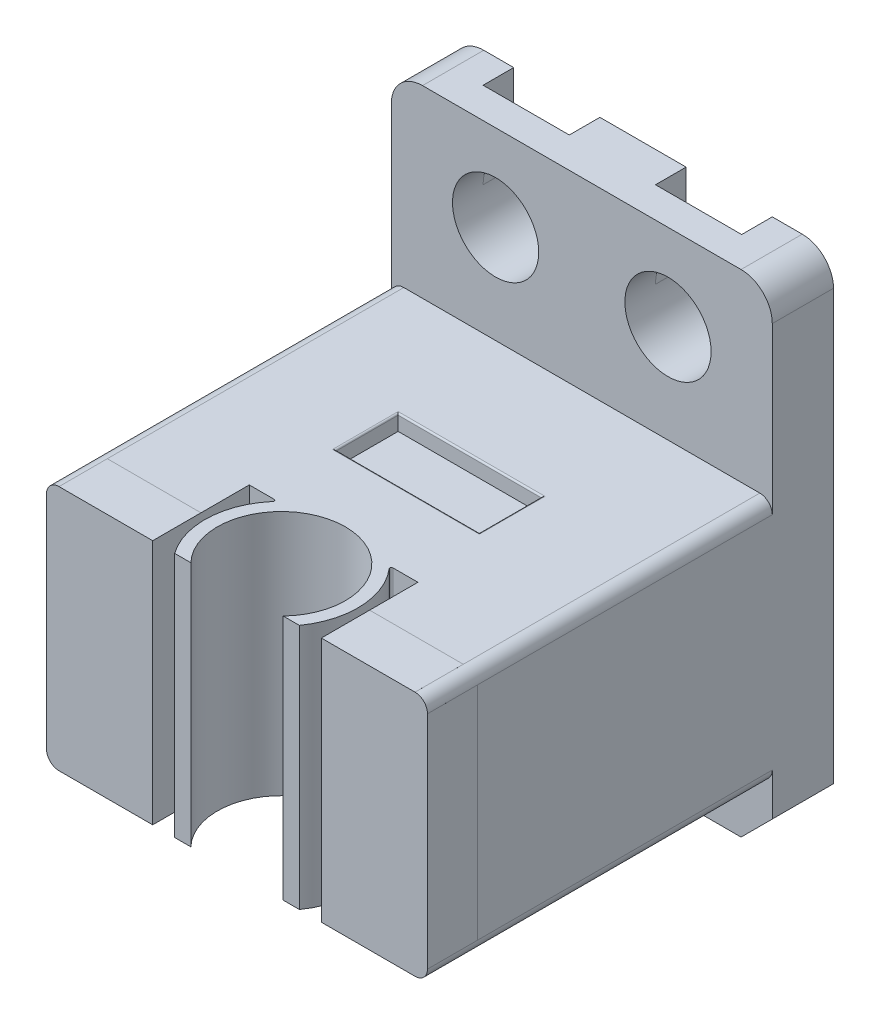
from build123d import *
from build123d.topology import SkipClean

# Parameters (mm, degrees)
SKETCH2_R                       = 1.7526
BOSS_EXTRUDE1_DEPTH             = 2.4892
BOSS_EXTRUDE2_DEPTH             = 14.0208
SKETCH4_R                       = 2.6035
CUT_EXTRUDE3_DEPTH              = 26.275820647
SKETCH5_W                       = 5.842
SKETCH5_H                       = 2.54
CUT_EXTRUDE4_DEPTH              = 0.635
FILLET1_R                       = 0.06477
BOSS_EXTRUDE3_REACH             = 29.059
SKETCH6_R                       = 2.6035
BOSS_EXTRUDE3_DIRECTION_2_DEPTH = 1.27
SKETCH7_R                       = 2.3495
BOSS_EXTRUDE4_DEPTH             = 0.7366
FILLET2_R                       = 0.127
SKETCH8_W                       = 3.5052
SKETCH8_H                       = 1.2446
CUT_EXTRUDE5_DEPTH              = 3.5052
CHAMFER1_SIZE                   = 1.27
SKETCH11_W                      = 3.81
SKETCH11_H                      = 1.963784076
BOSS_EXTRUDE5_DEPTH             = 0.000254
SKETCH12_W                      = 2.032
SKETCH12_H                      = 8.9916
BOSS_EXTRUDE6_DEPTH             = 0.000254
SKETCH14_W                      = 3.81
SKETCH14_H                      = 1.963784076
SKETCH14_H_2                    = 2.032
BOSS_EXTRUDE7_DEPTH             = 0.000254
SKETCH15_W                      = 2.032
SKETCH15_H                      = 8.9916
BOSS_EXTRUDE8_DEPTH             = 0.000254
SKETCH19_W                      = 0.142467949
SKETCH19_H                      = 1.160096154
BOSS_EXTRUDE9_DEPTH             = 0.000254


with BuildPart() as part:
    # Sketch2 → Boss-Extrude1 (new body)
    with BuildSketch(Plane.XY):
        with BuildLine():
            Line((-6.477, 9.9949), (6.477, 9.9949))
            ThreePointArc((6.477, 9.9949), (7.375025612, 9.622925612), (7.747, 8.7249))
            Line((7.747, 8.7249), (7.747, -9.9949))
            Line((7.747, -9.9949), (-7.747, -9.9949))
            Line((-7.747, -9.9949), (-7.747, 8.7249))
            ThreePointArc((-7.747, 8.7249), (-7.375025612, 9.622925612), (-6.477, 9.9949))
        make_face()
        with Locations((-3.5052, 6.4897)):
            Circle(SKETCH2_R, mode=Mode.SUBTRACT)
        with Locations((3.5052, 6.4897)):
            Circle(SKETCH2_R, mode=Mode.SUBTRACT)
    extrude(amount=BOSS_EXTRUDE1_DEPTH)

    # Sketch3 → Boss-Extrude2 (add)
    with BuildSketch(Plane.XY.offset(2.4892)):
        with BuildLine():
            Line((-7.239, 2.5019), (7.239, 2.5019))
            ThreePointArc((7.239, 2.5019), (7.598210245, 2.353110245), (7.747, 1.9939))
            Line((7.747, 1.9939), (7.747, -6.9977))
            ThreePointArc((7.747, -6.9977), (7.598210245, -7.356910245), (7.239, -7.5057))
            Line((7.239, -7.5057), (-7.239, -7.5057))
            ThreePointArc((-7.239, -7.5057), (-7.598210245, -7.356910245), (-7.747, -6.9977))
            Line((-7.747, -6.9977), (-7.747, 1.9939))
            ThreePointArc((-7.747, 1.9939), (-7.598210245, 2.353110245), (-7.239, 2.5019))
        make_face()
    extrude(amount=BOSS_EXTRUDE2_DEPTH)

    # Sketch4 → Cut-Extrude3 (cut, through all)
    with BuildSketch(Plane.XZ.offset(7.5057)):
        with Locations((0, 14.7066)):
            Circle(SKETCH4_R)
        with BuildLine():
            Line((-3.429, 12.582431848), (-2.413, 12.582431848))
            ThreePointArc((-2.413, 12.582431848), (-2.356345068, 12.618703282), (-2.365572682, 12.685338479))
            ThreePointArc((-2.365572682, 12.685338479), (-3.108430548, 14.568426992), (-2.535582909, 16.51))
            Line((-2.535582909, 16.51), (-3.429, 16.51))
            Line((-3.429, 16.51), (-3.429, 12.582431848))
        make_face()
        with BuildLine():
            Line((3.429, 16.51), (3.429, 12.582431848))
            Line((3.429, 12.582431848), (2.413, 12.582431848))
            ThreePointArc((2.413, 12.582431848), (2.356345068, 12.618703282), (2.365572682, 12.685338479))
            ThreePointArc((2.365572682, 12.685338479), (3.108430548, 14.568426992), (2.535582909, 16.51))
            Line((2.535582909, 16.51), (3.429, 16.51))
        make_face()
    extrude(amount=-CUT_EXTRUDE3_DEPTH, mode=Mode.SUBTRACT)

    # Sketch5 → Cut-Extrude4 (cut)
    with BuildSketch(Plane(origin=(0, 2.5019, 0), x_dir=(1, 0, 0), z_dir=(0, 1, 0))):
        with Locations((0, -8.3058)):
            Rectangle(SKETCH5_W, SKETCH5_H)
    extrude(amount=-CUT_EXTRUDE4_DEPTH, mode=Mode.SUBTRACT)

    # Fillet1
    fillet1_edges = [part.edges().sort_by_distance(p)[0] for p in [
        (-2.921, 2.5019, 8.3058),
        (0, 2.5019, 7.0358),
        (2.921, 2.5019, 8.3058),
        (0, 2.5019, 9.5758),
    ]]
    fillet(fillet1_edges, radius=FILLET1_R)

    # Sketch6 → Boss-Extrude3 (add, up to next)
    with BuildSketch(Plane.XZ.offset(9.9949), mode=Mode.PRIVATE) as boss_extrude3_sk1:
        with Locations((0, 2.9972)):
            Circle(SKETCH6_R)
    boss_extrude3_tool1 = extrude(boss_extrude3_sk1.sketch, amount=-BOSS_EXTRUDE3_REACH, mode=Mode.PRIVATE) - part.part
    add(boss_extrude3_tool1.solids().sort_by_distance((0, -9.9949, 2.9972))[0])

    # Sketch6 → Boss-Extrude3 direction 2 (add)
    with SkipClean():  # the faces are left unmerged after this step: merging them gives an invalid solid
        with BuildSketch(Plane.XZ.offset(9.9949)):
            with Locations((0, 2.9972)):
                Circle(SKETCH6_R)
        extrude(amount=BOSS_EXTRUDE3_DIRECTION_2_DEPTH)
    add(part.part.scale(1), mode=Mode.REPLACE)  # the faces are merged on a copy

    # Sketch7 → Boss-Extrude4 (add)
    with BuildSketch(Plane.XZ.offset(11.2649)):
        with Locations((0, 2.9972)):
            Circle(SKETCH7_R)
    extrude(amount=BOSS_EXTRUDE4_DEPTH)

    # Fillet2
    fillet2_edges = [part.edges().sort_by_distance(p)[0] for p in [
        (-2.3495, -11.2649, 2.9972),
    ]]
    fillet(fillet2_edges, radius=FILLET2_R)

    # Sketch8 → Cut-Extrude5 (cut)
    with SkipClean():  # the faces are left unmerged after this step: merging them gives an invalid solid
        with BuildSketch(Plane(origin=(0, 9.9949, 0), x_dir=(1, 0, 0), z_dir=(0, 1, 0))):
            with Locations((3.5052, -0.6223)):
                Rectangle(SKETCH8_W, SKETCH8_H)
            with Locations((-3.5052, -0.6223)):
                Rectangle(SKETCH8_W, SKETCH8_H)
        extrude(amount=-CUT_EXTRUDE5_DEPTH, mode=Mode.SUBTRACT)

    # Chamfer1
    chamfer1_edges = [part.edges().sort_by_distance(p)[0] for p in [
        (-7.747, -9.9949, 1.2446),
        (7.747, -9.9949, 1.2446),
    ]]
    chamfer(chamfer1_edges, length=CHAMFER1_SIZE)

    # Sketch11 → Boss-Extrude5 (add)
    with SkipClean():  # the faces are left unmerged after this step: merging them gives an invalid solid
        with BuildSketch(Plane(origin=(0, 2.5019, 0), x_dir=(1, 0, 0), z_dir=(0, 1, 0))):
            with Locations((5.334, -15.528107962)):
                Rectangle(SKETCH11_W, SKETCH11_H)
            with Locations((-5.334, -15.528107962)):
                Rectangle(SKETCH11_W, SKETCH11_H)
        extrude(amount=BOSS_EXTRUDE5_DEPTH)

    # Sketch12 → Boss-Extrude6 (add)
    with SkipClean():  # the faces are left unmerged after this step: merging them gives an invalid solid
        with BuildSketch(Plane(origin=(7.747, 0, 0), x_dir=(0, 0, -1), z_dir=(1, 0, 0))):
            with Locations((-15.494, -2.5019)):
                Rectangle(SKETCH12_W, SKETCH12_H)
        extrude(amount=BOSS_EXTRUDE6_DEPTH)

    # Sketch14 → Boss-Extrude7 (add)
    with SkipClean():  # the faces are left unmerged after this step: merging them gives an invalid solid
        with BuildSketch(Plane.XZ.offset(7.5057)):
            with Locations((-5.334, 15.528107962)):
                Rectangle(SKETCH14_W, SKETCH14_H)
            with Locations((5.334, 15.494)):
                Rectangle(SKETCH14_W, SKETCH14_H_2)
        extrude(amount=BOSS_EXTRUDE7_DEPTH)

    # Sketch15 → Boss-Extrude8 (add)
    with SkipClean():  # the faces are left unmerged after this step: merging them gives an invalid solid
        with BuildSketch(Plane.ZY.offset(7.747)):
            with Locations((15.494, -2.5019)):
                Rectangle(SKETCH15_W, SKETCH15_H)
        extrude(amount=BOSS_EXTRUDE8_DEPTH)

    # Sketch19 → Boss-Extrude9 (add)
    # profile 1 of 10: a face of its own
    with SkipClean():  # the faces are left unmerged after this step: merging them gives an invalid solid
        with BuildSketch(Plane.ZY.offset(7.747)):
            with BuildLine():
                Line((2.754533945, -1.406853602), (3.065864574, -1.406853602))
                add(Edge.make_bspline(
                    [(3.065864574, -1.406853602), (3.087278092, -1.40687714), (3.128307344, -1.406922241), (3.187142387, -1.408289644), (3.240577515, -1.410116037), (3.288497509, -1.412647824), (3.331049811, -1.415639849), (3.368041872, -1.419836309), (3.399764456, -1.424217943), (3.418772024, -1.428672653), (3.427440595, -1.430704263)],
                    knots=[0, 0, 0, 0, 1.415646017, 2.712440637, 3.8905458, 4.950247383, 5.884950622, 6.709939814, 7.411656543, 8, 8, 8, 8], degree=3))
                add(Edge.make_bspline(
                    [(3.427440595, -1.430704263), (3.438414091, -1.43370779), (3.460102506, -1.43964407), (3.49135405, -1.451533866), (3.521087402, -1.465631848), (3.549404573, -1.481699135), (3.575957589, -1.500425088), (3.601142615, -1.521050621), (3.624737392, -1.54405194), (3.646609237, -1.569171061), (3.666695556, -1.595986299), (3.683990091, -1.624897954), (3.698471369, -1.655419366), (3.710891638, -1.687529307), (3.71983083, -1.721497418), (3.72656496, -1.757087677), (3.730839248, -1.794296269), (3.731248624, -1.819723423), (3.731457022, -1.832667404)],
                    knots=[0, 0, 0, 0, 0.999701418, 1.975846123, 2.934577507, 3.890451536, 4.834027766, 5.787354733, 6.749476667, 7.726910423, 8.712836071, 9.690891519, 10.682875813, 11.679750201, 12.712814741, 13.765529915, 14.8625177, 16, 16, 16, 16], degree=3))
                add(Edge.make_bspline(
                    [(3.731457022, -1.832667404), (3.731265876, -1.845720181), (3.730891885, -1.871258822), (3.726403213, -1.908620765), (3.720357019, -1.944325177), (3.711060141, -1.978292892), (3.698883711, -2.010322188), (3.684599816, -2.040902533), (3.667371572, -2.06951367), (3.647575524, -2.09625947), (3.625553908, -2.121165037), (3.601399897, -2.14404989), (3.575211003, -2.164780072), (3.547070457, -2.183402057), (3.516703919, -2.199484012), (3.484571942, -2.213888218), (3.450395237, -2.225985449), (3.426744882, -2.232349084), (3.414720243, -2.235584571)],
                    knots=[0, 0, 0, 0, 1.121902311, 2.195077645, 3.232258892, 4.234102512, 5.217864754, 6.176164875, 7.132989551, 8.084763148, 9.034132444, 9.988522005, 10.94243251, 11.903244335, 12.886203696, 13.894208494, 14.929344452, 16, 16, 16, 16], degree=3))
                add(Edge.make_bspline(
                    [(3.414720243, -2.235584571), (3.404774631, -2.237699566), (3.382978243, -2.242334701), (3.347081366, -2.247509251), (3.305286851, -2.251925948), (3.257651746, -2.255237536), (3.204218807, -2.258072524), (3.144959129, -2.26032591), (3.079756387, -2.261564093), (3.034276216, -2.261627953), (3.01053104, -2.261661294)],
                    knots=[0, 0, 0, 0, 0.601384939, 1.31797006, 2.144135048, 3.087295005, 4.142315834, 5.309527816, 6.595305764, 8, 8, 8, 8], degree=3))
                Line((3.01053104, -2.261661294), (2.897001894, -2.261661294))
                Line((2.897001894, -2.261661294), (2.897001894, -2.994353602))
                Line((2.897001894, -2.994353602), (2.754533945, -2.994353602))
                Line((2.754533945, -2.994353602), (2.754533945, -1.406853602))
            make_face()
            with BuildLine():
                Line((2.897001894, -1.569674115), (2.897001894, -2.098840781))
                Line((2.897001894, -2.098840781), (3.174941597, -2.102338878))
                add(Edge.make_bspline(
                    [(3.174941597, -2.102338878), (3.188512421, -2.102345892), (3.214710616, -2.102359432), (3.252554903, -2.100551849), (3.287665544, -2.098465178), (3.31993469, -2.095409956), (3.349376889, -2.091091386), (3.376041233, -2.086731776), (3.399720964, -2.080424701), (3.427433817, -2.071932452), (3.458314478, -2.057448729), (3.491909402, -2.036425744), (3.520380346, -2.009628422), (3.545017574, -1.979498656), (3.564569168, -1.945980122), (3.578882065, -1.910116712), (3.587291804, -1.872276223), (3.58841947, -1.846382674), (3.588989073, -1.833303421)],
                    knots=[0, 0, 0, 0, 1.160613943, 2.240541288, 3.23993089, 4.169200891, 5.011653406, 5.7853311, 6.478053781, 7.106038997, 8.262395093, 9.384106736, 10.481365981, 11.59014053, 12.70357646, 13.786202915, 14.881775077, 16, 16, 16, 16], degree=3))
                add(Edge.make_bspline(
                    [(3.588989073, -1.833303421), (3.588416373, -1.820540596), (3.587277915, -1.795169678), (3.578816149, -1.757986454), (3.564596996, -1.722500974), (3.544886326, -1.689402467), (3.520964456, -1.659381117), (3.493160826, -1.633302063), (3.461540882, -1.612337219), (3.432127577, -1.598805695), (3.406001325, -1.590543767), (3.383308258, -1.584763071), (3.357685702, -1.580147707), (3.329125316, -1.576410504), (3.297848466, -1.573211255), (3.263586445, -1.571040473), (3.226469042, -1.569769812), (3.200701391, -1.569706786), (3.187343941, -1.569674115)],
                    knots=[0, 0, 0, 0, 1.120700087, 2.227813068, 3.331159281, 4.466773991, 5.599788987, 6.693661531, 7.80175334, 8.91857717, 9.525282508, 10.207424825, 10.974604443, 11.810962634, 12.737642355, 13.736264703, 14.826523623, 16, 16, 16, 16], degree=3))
                Line((3.187343941, -1.569674115), (2.897001894, -1.569674115))
            make_face(mode=Mode.SUBTRACT)
        # profile 2 of 10: a face of its own
        with BuildSketch(Plane.ZY.offset(7.747)):
            with BuildLine():
                Line((5.196841637, -1.834257448), (5.196841637, -2.994353602))
                Line((5.196841637, -2.994353602), (5.054373688, -2.994353602))
                Line((5.054373688, -2.994353602), (5.054373688, -2.79369004))
                add(Edge.make_bspline(
                    [(5.054373688, -2.79369004), (5.038308737, -2.811850856), (5.006957782, -2.847291916), (4.954596989, -2.893593473), (4.89909428, -2.931865069), (4.840719038, -2.962775924), (4.779523978, -2.985995178), (4.715644752, -3.0024989), (4.649055305, -3.013109675), (4.603583701, -3.014169228), (4.580540555, -3.014706166)],
                    knots=[0, 0, 0, 0, 1.074387032, 2.096679803, 3.090159297, 4.057316773, 5.018401886, 5.985159533, 6.978961417, 8, 8, 8, 8], degree=3))
                add(Edge.make_bspline(
                    [(4.580540555, -3.014706166), (4.560053662, -3.014149918), (4.519652601, -3.013052974), (4.460221556, -3.004542929), (4.403029714, -2.99087654), (4.348023033, -2.971871494), (4.295557452, -2.946661621), (4.245183766, -2.916480412), (4.197162938, -2.880539035), (4.152226918, -2.839450894), (4.110846689, -2.794821739), (4.074533184, -2.747221438), (4.044255894, -2.696855821), (4.0189375, -2.644362569), (3.999435587, -2.589337588), (3.985840403, -2.531971158), (3.977340271, -2.472331108), (3.97624378, -2.431718539), (3.975687791, -2.411125437)],
                    knots=[0, 0, 0, 0, 1.033919861, 2.038935746, 3.024066025, 3.998881131, 4.97069526, 5.957263378, 6.95902576, 7.993208707, 9.027059324, 10.027763471, 11.009749337, 11.988697705, 12.965288445, 13.950418724, 14.960734635, 16, 16, 16, 16], degree=3))
                add(Edge.make_bspline(
                    [(3.975687791, -2.411125437), (3.976256103, -2.390957971), (3.977379625, -2.35108798), (3.985749478, -2.292450856), (3.999824257, -2.235972931), (4.019576317, -2.181836031), (4.044904632, -2.129974651), (4.075714872, -2.080352111), (4.11200926, -2.032831706), (4.153852316, -1.988530828), (4.199179873, -1.947609335), (4.247670619, -1.912045233), (4.298118321, -1.881330805), (4.351305472, -1.856995121), (4.406444838, -1.837305991), (4.464027294, -1.823683895), (4.52381326, -1.815656896), (4.56440359, -1.814494499), (4.584992679, -1.813904884)],
                    knots=[0, 0, 0, 0, 1.020392517, 2.01726096, 2.990465484, 3.961182959, 4.928053699, 5.906110375, 6.912531644, 7.948652711, 8.985773172, 9.998621852, 10.987621588, 11.969261332, 12.953316658, 13.946091881, 14.958173133, 16, 16, 16, 16], degree=3))
                add(Edge.make_bspline(
                    [(4.584992679, -1.813904884), (4.608669043, -1.814557007), (4.655097277, -1.815835789), (4.723009624, -1.826477812), (4.787255512, -1.844456688), (4.848330879, -1.868912125), (4.906016405, -1.901409941), (4.959765973, -1.942403709), (5.010142102, -1.99163489), (5.039343163, -2.029449342), (5.054373688, -2.048913397)],
                    knots=[0, 0, 0, 0, 1.038897134, 2.037228247, 3.008116434, 3.962042015, 4.918381754, 5.904844433, 6.921570401, 8, 8, 8, 8], degree=3))
                Line((5.054373688, -2.048913397), (5.054373688, -1.834257448))
                Line((5.054373688, -1.834257448), (5.196841637, -1.834257448))
            make_face()
            with BuildLine():
                add(Edge.make_bspline(
                    [(4.586900732, -1.956372832), (4.5660753, -1.957113804), (4.52496921, -1.958576364), (4.464624252, -1.969994342), (4.406878525, -1.988991997), (4.352020841, -2.014973431), (4.300917757, -2.047643608), (4.255245985, -2.087159378), (4.214631974, -2.132442595), (4.180474297, -2.18328891), (4.152629322, -2.237798258), (4.133049989, -2.294777914), (4.120137152, -2.353200171), (4.11881793, -2.39282539), (4.11815574, -2.412715481)],
                    knots=[0, 0, 0, 0, 1.031046209, 2.035121221, 3.029706178, 4.034933723, 5.034054252, 6.02443088, 7.017295772, 8.038157696, 9.050218397, 10.03989886, 11.016116709, 12, 12, 12, 12], degree=3))
                add(Edge.make_bspline(
                    [(4.11815574, -2.412715481), (4.119001602, -2.432486708), (4.120690011, -2.471951666), (4.132823362, -2.53045357), (4.15317959, -2.587446654), (4.18095724, -2.642447176), (4.215740102, -2.693512107), (4.256057455, -2.73965852), (4.30229919, -2.779341297), (4.353519881, -2.812559768), (4.40822421, -2.839394197), (4.465752457, -2.858065755), (4.525023193, -2.870120677), (4.565324073, -2.871528779), (4.585628696, -2.872238217)],
                    knots=[0, 0, 0, 0, 0.979072187, 1.954306742, 2.945804271, 3.96968567, 4.997920485, 5.998718438, 6.996577872, 8.005894225, 9.015743152, 10.005417472, 10.995077863, 12, 12, 12, 12], degree=3))
                add(Edge.make_bspline(
                    [(4.585628696, -2.872238217), (4.606241932, -2.871485305), (4.647239612, -2.869987837), (4.707763597, -2.858520978), (4.766498813, -2.839575844), (4.822645163, -2.813314454), (4.874949265, -2.780767368), (4.921892945, -2.742664152), (4.961587688, -2.698348779), (4.995239336, -2.649645888), (5.021626043, -2.596255089), (5.040846612, -2.539407081), (5.052210348, -2.479099885), (5.053642604, -2.437886604), (5.054373688, -2.416849595)],
                    knots=[0, 0, 0, 0, 1.01762866, 2.023962475, 3.030623092, 4.058876274, 5.077231937, 6.066672613, 7.034107872, 8.005628644, 8.981990164, 9.965428785, 10.961468474, 12, 12, 12, 12], degree=3))
                add(Edge.make_bspline(
                    [(5.054373688, -2.416849595), (5.053938416, -2.400821365), (5.053081661, -2.369272736), (5.046536367, -2.322950612), (5.036124668, -2.278621386), (5.02145337, -2.236238452), (5.002180537, -2.196036141), (4.978936015, -2.157725793), (4.951311043, -2.121506658), (4.91975032, -2.087877479), (4.885203961, -2.057204048), (4.84864858, -2.029824553), (4.809651077, -2.007332503), (4.768867278, -1.988717355), (4.726226422, -1.973904097), (4.681381534, -1.964021822), (4.634809279, -1.957236248), (4.60303839, -1.956663668), (4.586900732, -1.956372832)],
                    knots=[0, 0, 0, 0, 1.050140795, 2.067009409, 3.05949893, 4.030605086, 5.00011959, 5.97591094, 6.962425594, 7.979863591, 8.993523472, 9.986985069, 10.967611495, 11.937549037, 12.921786183, 13.919465291, 14.943216303, 16, 16, 16, 16], degree=3))
            make_face(mode=Mode.SUBTRACT)
        # profile 3 of 10: a face of its own
        with BuildSketch(Plane.ZY.offset(7.747)):
            with BuildLine():
                Line((5.522482663, -1.834257448), (5.664950611, -1.834257448))
                Line((5.664950611, -1.834257448), (5.664950611, -2.043507248))
                add(Edge.make_bspline(
                    [(5.664950611, -2.043507248), (5.680162325, -2.024528584), (5.709681185, -1.987699825), (5.758841221, -1.939294422), (5.810795062, -1.89940498), (5.865224542, -1.867607902), (5.92220355, -1.843638183), (5.981384766, -1.826327207), (6.043122507, -1.815947302), (6.085107091, -1.814591019), (6.106346845, -1.813904884)],
                    knots=[0, 0, 0, 0, 1.12780773, 2.188550248, 3.19190651, 4.159438251, 5.104880172, 6.052711206, 7.014878035, 8, 8, 8, 8], degree=3))
                add(Edge.make_bspline(
                    [(6.106346845, -1.813904884), (6.127814669, -1.814696455), (6.169832377, -1.81624575), (6.231009212, -1.828499749), (6.288147145, -1.849429918), (6.341042443, -1.878101107), (6.388725143, -1.913754757), (6.430601058, -1.955291823), (6.465237245, -2.003069261), (6.488458906, -2.047393692), (6.503755897, -2.086713252), (6.513386278, -2.120389457), (6.521564616, -2.157908047), (6.528654731, -2.199155646), (6.533452206, -2.244421254), (6.537236031, -2.293519314), (6.539947796, -2.346433923), (6.540055387, -2.383031072), (6.540110868, -2.401903181)],
                    knots=[0, 0, 0, 0, 1.235846778, 2.418850247, 3.575807741, 4.728682307, 5.871620074, 6.994088408, 8.11269785, 9.256955736, 9.865816715, 10.540099792, 11.271859618, 12.076849838, 12.949306005, 13.892391288, 14.913166135, 16, 16, 16, 16], degree=3))
                Line((6.540110868, -2.401903181), (6.540110868, -2.994353602))
                Line((6.540110868, -2.994353602), (6.397642919, -2.994353602))
                Line((6.397642919, -2.994353602), (6.397642919, -2.448650477))
                add(Edge.make_bspline(
                    [(6.397642919, -2.448650477), (6.397555286, -2.432856011), (6.397387657, -2.402643885), (6.396858953, -2.359387221), (6.395584505, -2.32015938), (6.393793663, -2.285054145), (6.39117246, -2.254105227), (6.388440767, -2.227249591), (6.385100224, -2.204521334), (6.382123474, -2.190839314), (6.380788452, -2.184703161)],
                    knots=[0, 0, 0, 0, 1.430800155, 2.736877192, 3.918605307, 4.986035426, 5.920637409, 6.731861385, 7.431261377, 8, 8, 8, 8], degree=3))
                add(Edge.make_bspline(
                    [(6.380788452, -2.184703161), (6.375969015, -2.166691302), (6.366693088, -2.132024047), (6.343772318, -2.085000322), (6.314828028, -2.044996144), (6.27949579, -2.012258845), (6.238116887, -1.986781359), (6.190806148, -1.969103887), (6.138020121, -1.958047507), (6.100893312, -1.95694663), (6.081542158, -1.956372832)],
                    knots=[0, 0, 0, 0, 1.084156227, 2.086665306, 3.027808233, 3.945421172, 4.874247719, 5.839848303, 6.874090471, 8, 8, 8, 8], degree=3))
                add(Edge.make_bspline(
                    [(6.081542158, -1.956372832), (6.070081459, -1.956588735), (6.047401031, -1.957015999), (6.013768722, -1.961302838), (5.981145972, -1.968314352), (5.949205377, -1.97777977), (5.918585771, -1.990780156), (5.888303396, -2.005534549), (5.859498542, -2.023926059), (5.831557001, -2.044423234), (5.805561549, -2.067137732), (5.781373339, -2.091106492), (5.759811451, -2.116631498), (5.74027673, -2.143301474), (5.723413732, -2.1714827), (5.708693939, -2.200903296), (5.696204534, -2.231601985), (5.689998456, -2.252908531), (5.68689322, -2.263569347)],
                    knots=[0, 0, 0, 0, 1.023777757, 2.026029729, 3.023749952, 4.003683103, 4.997618607, 5.993177895, 7.010360494, 8.046726602, 9.087585522, 10.09234134, 11.086953743, 12.070360549, 13.043493632, 14.017870808, 15.008233677, 16, 16, 16, 16], degree=3))
                add(Edge.make_bspline(
                    [(5.68689322, -2.263569347), (5.685106308, -2.271395814), (5.681216294, -2.288433623), (5.67701478, -2.316393771), (5.673201344, -2.348737938), (5.670009581, -2.385428382), (5.668056767, -2.426593561), (5.665927522, -2.472057673), (5.665152341, -2.522002005), (5.665019738, -2.556773559), (5.664950611, -2.574899976)],
                    knots=[0, 0, 0, 0, 0.615963638, 1.340920617, 2.168419149, 3.115676021, 4.16674242, 5.331190069, 6.6087489, 8, 8, 8, 8], degree=3))
                Line((5.664950611, -2.574899976), (5.664950611, -2.994353602))
                Line((5.664950611, -2.994353602), (5.522482663, -2.994353602))
                Line((5.522482663, -2.994353602), (5.522482663, -1.834257448))
            make_face()
        # profile 4 of 10: a face of its own
        with BuildSketch(Plane.ZY.offset(7.747)):
            with BuildLine():
                Line((8.046200611, -1.834257448), (8.046200611, -2.994353602))
                Line((8.046200611, -2.994353602), (7.903732663, -2.994353602))
                Line((7.903732663, -2.994353602), (7.903732663, -2.79369004))
                add(Edge.make_bspline(
                    [(7.903732663, -2.79369004), (7.887667711, -2.811850856), (7.856316757, -2.847291916), (7.803955964, -2.893593473), (7.748453254, -2.931865069), (7.690078012, -2.962775924), (7.628882952, -2.985995178), (7.565003727, -3.0024989), (7.498414279, -3.013109675), (7.452942675, -3.014169228), (7.42989953, -3.014706166)],
                    knots=[0, 0, 0, 0, 1.074387032, 2.096679803, 3.090159297, 4.057316773, 5.018401886, 5.985159533, 6.978961417, 8, 8, 8, 8], degree=3))
                add(Edge.make_bspline(
                    [(7.42989953, -3.014706166), (7.409412636, -3.014149918), (7.369011576, -3.013052974), (7.30958053, -3.004542929), (7.252388688, -2.99087654), (7.197382007, -2.971871494), (7.144916427, -2.946661621), (7.09454274, -2.916480412), (7.046521912, -2.880539035), (7.001585892, -2.839450894), (6.960205664, -2.794821739), (6.923892158, -2.747221438), (6.893614868, -2.696855821), (6.868296474, -2.644362569), (6.848794561, -2.589337588), (6.835199377, -2.531971158), (6.826699246, -2.472331108), (6.825602755, -2.431718539), (6.825046765, -2.411125437)],
                    knots=[0, 0, 0, 0, 1.033919861, 2.038935746, 3.024066025, 3.998881131, 4.97069526, 5.957263378, 6.95902576, 7.993208707, 9.027059324, 10.027763471, 11.009749337, 11.988697705, 12.965288445, 13.950418724, 14.960734635, 16, 16, 16, 16], degree=3))
                add(Edge.make_bspline(
                    [(6.825046765, -2.411125437), (6.825615077, -2.390957971), (6.8267386, -2.35108798), (6.835108453, -2.292450856), (6.849183232, -2.235972931), (6.868935291, -2.181836031), (6.894263607, -2.129974651), (6.925073846, -2.080352111), (6.961368235, -2.032831706), (7.003211291, -1.988530828), (7.048538847, -1.947609335), (7.097029593, -1.912045233), (7.147477296, -1.881330805), (7.200664447, -1.856995121), (7.255803812, -1.837305991), (7.313386268, -1.823683895), (7.373172234, -1.815656896), (7.413762564, -1.814494499), (7.434351653, -1.813904884)],
                    knots=[0, 0, 0, 0, 1.020392517, 2.01726096, 2.990465484, 3.961182959, 4.928053699, 5.906110375, 6.912531644, 7.948652711, 8.985773172, 9.998621852, 10.987621588, 11.969261332, 12.953316658, 13.946091881, 14.958173133, 16, 16, 16, 16], degree=3))
                add(Edge.make_bspline(
                    [(7.434351653, -1.813904884), (7.458028018, -1.814557007), (7.504456251, -1.815835789), (7.572368599, -1.826477812), (7.636614487, -1.844456688), (7.697689854, -1.868912125), (7.755375379, -1.901409941), (7.809124947, -1.942403709), (7.859501077, -1.99163489), (7.888702138, -2.029449342), (7.903732663, -2.048913397)],
                    knots=[0, 0, 0, 0, 1.038897134, 2.037228247, 3.008116434, 3.962042015, 4.918381754, 5.904844433, 6.921570401, 8, 8, 8, 8], degree=3))
                Line((7.903732663, -2.048913397), (7.903732663, -1.834257448))
                Line((7.903732663, -1.834257448), (8.046200611, -1.834257448))
            make_face()
            with BuildLine():
                add(Edge.make_bspline(
                    [(7.436259706, -1.956372832), (7.415434274, -1.957113804), (7.374328184, -1.958576364), (7.313983226, -1.969994342), (7.256237499, -1.988991997), (7.201379815, -2.014973431), (7.150276731, -2.047643608), (7.104604959, -2.087159378), (7.063990948, -2.132442595), (7.029833271, -2.18328891), (7.001988296, -2.237798258), (6.982408964, -2.294777914), (6.969496126, -2.353200171), (6.968176905, -2.39282539), (6.967514714, -2.412715481)],
                    knots=[0, 0, 0, 0, 1.031046209, 2.035121221, 3.029706178, 4.034933723, 5.034054252, 6.02443088, 7.017295772, 8.038157696, 9.050218397, 10.03989886, 11.016116709, 12, 12, 12, 12], degree=3))
                add(Edge.make_bspline(
                    [(6.967514714, -2.412715481), (6.968360576, -2.432486708), (6.970048986, -2.471951666), (6.982182336, -2.53045357), (7.002538565, -2.587446654), (7.030316214, -2.642447176), (7.065099076, -2.693512107), (7.105416429, -2.73965852), (7.151658164, -2.779341297), (7.202878855, -2.812559768), (7.257583184, -2.839394197), (7.315111432, -2.858065755), (7.374382168, -2.870120677), (7.414683048, -2.871528779), (7.434987671, -2.872238217)],
                    knots=[0, 0, 0, 0, 0.979072187, 1.954306742, 2.945804271, 3.96968567, 4.997920485, 5.998718438, 6.996577872, 8.005894225, 9.015743152, 10.005417472, 10.995077863, 12, 12, 12, 12], degree=3))
                add(Edge.make_bspline(
                    [(7.434987671, -2.872238217), (7.455600906, -2.871485305), (7.496598586, -2.869987837), (7.557122572, -2.858520978), (7.615857787, -2.839575844), (7.672004137, -2.813314454), (7.724308239, -2.780767368), (7.771251919, -2.742664152), (7.810946662, -2.698348779), (7.84459831, -2.649645888), (7.870985017, -2.596255089), (7.890205587, -2.539407081), (7.901569323, -2.479099885), (7.903001579, -2.437886604), (7.903732663, -2.416849595)],
                    knots=[0, 0, 0, 0, 1.01762866, 2.023962475, 3.030623092, 4.058876274, 5.077231937, 6.066672613, 7.034107872, 8.005628644, 8.981990164, 9.965428785, 10.961468474, 12, 12, 12, 12], degree=3))
                add(Edge.make_bspline(
                    [(7.903732663, -2.416849595), (7.90329739, -2.400821365), (7.902440636, -2.369272736), (7.895895342, -2.322950612), (7.885483643, -2.278621386), (7.870812344, -2.236238452), (7.851539512, -2.196036141), (7.828294989, -2.157725793), (7.800670017, -2.121506658), (7.769109295, -2.087877479), (7.734562935, -2.057204048), (7.698007554, -2.029824553), (7.659010051, -2.007332503), (7.618226252, -1.988717355), (7.575585397, -1.973904097), (7.530740508, -1.964021822), (7.484168254, -1.957236248), (7.452397364, -1.956663668), (7.436259706, -1.956372832)],
                    knots=[0, 0, 0, 0, 1.050140795, 2.067009409, 3.05949893, 4.030605086, 5.00011959, 5.97591094, 6.962425594, 7.979863591, 8.993523472, 9.986985069, 10.967611495, 11.937549037, 12.921786183, 13.919465291, 14.943216303, 16, 16, 16, 16], degree=3))
            make_face(mode=Mode.SUBTRACT)
        # profile 5 of 10: a face of its own
        with BuildSketch(Plane.ZY.offset(7.747)):
            with BuildLine():
                Line((8.921360868, -1.978951458), (8.824686188, -2.078488217))
                add(Edge.make_bspline(
                    [(8.824686188, -2.078488217), (8.816344781, -2.068821183), (8.800263531, -2.050184279), (8.774758538, -2.025266395), (8.749347832, -2.004339998), (8.724379263, -1.986672366), (8.699224976, -1.973315075), (8.67418016, -1.963565619), (8.649218882, -1.9575323), (8.632533788, -1.95675468), (8.624340636, -1.956372832)],
                    knots=[0, 0, 0, 0, 1.26578478, 2.440284043, 3.530471711, 4.527705817, 5.468200915, 6.346673037, 7.188140097, 8, 8, 8, 8], degree=3))
                add(Edge.make_bspline(
                    [(8.624340636, -1.956372832), (8.614298841, -1.956860364), (8.59453801, -1.957819757), (8.566223442, -1.967396206), (8.539938695, -1.982095884), (8.517188922, -2.00294592), (8.497917724, -2.026878285), (8.483850804, -2.053637332), (8.475248376, -2.082415552), (8.474157658, -2.102386238), (8.473604458, -2.11251516)],
                    knots=[0, 0, 0, 0, 0.99966794, 1.967205029, 2.953328237, 3.988086729, 5.028030931, 6.008226631, 6.989793394, 8, 8, 8, 8], degree=3))
                add(Edge.make_bspline(
                    [(8.473604458, -2.11251516), (8.47410829, -2.121682766), (8.475114535, -2.139992134), (8.482937136, -2.167001421), (8.495394962, -2.193334435), (8.507038229, -2.209464753), (8.513037551, -2.217776078)],
                    knots=[0, 0, 0, 0, 0.960159726, 1.917612774, 2.927026955, 4, 4, 4, 4], degree=3))
                add(Edge.make_bspline(
                    [(8.513037551, -2.217776078), (8.516649564, -2.222214086), (8.524337279, -2.231659826), (8.538764712, -2.244769788), (8.55510349, -2.259257881), (8.574752177, -2.273743517), (8.59686425, -2.288997907), (8.621919211, -2.304420303), (8.649121933, -2.32118631), (8.668597068, -2.331820036), (8.678720143, -2.337347392)],
                    knots=[0, 0, 0, 0, 0.66740084, 1.420478572, 2.27185888, 3.217733974, 4.268547843, 5.408967954, 6.65319498, 8, 8, 8, 8], degree=3))
                add(Edge.make_bspline(
                    [(8.678720143, -2.337347392), (8.691063444, -2.344262044), (8.714906637, -2.357618876), (8.748785142, -2.378351491), (8.779531407, -2.398957887), (8.807405942, -2.419217686), (8.831872405, -2.439697737), (8.853673113, -2.459613041), (8.8722643, -2.479565334), (8.882675546, -2.493504997), (8.887651934, -2.500167905)],
                    knots=[0, 0, 0, 0, 1.27191281, 2.456916733, 3.569705269, 4.599008579, 5.553216877, 6.436649441, 7.252746552, 8, 8, 8, 8], degree=3))
                add(Edge.make_bspline(
                    [(8.887651934, -2.500167905), (8.895911709, -2.513623595), (8.912350194, -2.540402915), (8.929612336, -2.584498416), (8.939618246, -2.631266394), (8.941007182, -2.663257794), (8.941713432, -2.679524876)],
                    knots=[0, 0, 0, 0, 0.995354457, 1.980940102, 2.973342416, 4, 4, 4, 4], degree=3))
                add(Edge.make_bspline(
                    [(8.941713432, -2.679524876), (8.941387072, -2.690986239), (8.940743944, -2.713572106), (8.936272607, -2.746834689), (8.928582314, -2.778645721), (8.918107647, -2.809350368), (8.903963306, -2.838360315), (8.88738627, -2.866407471), (8.867485863, -2.892885126), (8.844765846, -2.917758511), (8.819889497, -2.940475975), (8.793352785, -2.960443983), (8.765123029, -2.977033057), (8.735401944, -2.990760553), (8.704122001, -3.001677227), (8.671278309, -3.009234875), (8.636975267, -3.013758235), (8.613648176, -3.014386194), (8.60176201, -3.014706166)],
                    knots=[0, 0, 0, 0, 1.032770009, 2.035186124, 3.017557409, 3.978232242, 4.952395191, 5.920591857, 6.910227898, 7.931268572, 8.952309245, 9.941945286, 10.918353717, 11.897095711, 12.887975737, 13.898235213, 14.929059601, 16, 16, 16, 16], degree=3))
                add(Edge.make_bspline(
                    [(8.60176201, -3.014706166), (8.585720469, -3.014255905), (8.553860285, -3.013361641), (8.506738876, -3.00496782), (8.460691961, -2.991907052), (8.416067998, -2.973893039), (8.373864939, -2.951146109), (8.335251984, -2.923903523), (8.300094999, -2.893065203), (8.280084211, -2.869428275), (8.270078817, -2.857609812)],
                    knots=[0, 0, 0, 0, 1.013940152, 2.01379169, 3.017749504, 4.037548394, 5.051665909, 6.043208538, 7.021604269, 8, 8, 8, 8], degree=3))
                Line((8.270078817, -2.857609812), (8.364527434, -2.750122832))
                add(Edge.make_bspline(
                    [(8.364527434, -2.750122832), (8.373495636, -2.759808744), (8.390881851, -2.778586347), (8.418686331, -2.803589173), (8.446979845, -2.824544749), (8.475479864, -2.842072298), (8.504608264, -2.85557757), (8.53420181, -2.865065647), (8.56420031, -2.871163548), (8.584348921, -2.871879412), (8.594447807, -2.872238217)],
                    knots=[0, 0, 0, 0, 1.179806542, 2.287233372, 3.337373186, 4.324005949, 5.273901747, 6.200048787, 7.097828587, 8, 8, 8, 8], degree=3))
                add(Edge.make_bspline(
                    [(8.594447807, -2.872238217), (8.608199152, -2.87161645), (8.635066973, -2.870401622), (8.673549678, -2.859372084), (8.709081841, -2.842077427), (8.739935287, -2.817546153), (8.766198053, -2.788991304), (8.785215475, -2.756826686), (8.797133597, -2.721996275), (8.798533318, -2.697851623), (8.799245483, -2.685567043)],
                    knots=[0, 0, 0, 0, 1.072336372, 2.095165389, 3.102688358, 4.141489647, 5.156069229, 6.117746104, 7.042326257, 8, 8, 8, 8], degree=3))
                add(Edge.make_bspline(
                    [(8.799245483, -2.685567043), (8.798752771, -2.675448038), (8.797779977, -2.655469416), (8.79014035, -2.626554082), (8.778069521, -2.599126944), (8.766183841, -2.583075211), (8.760130399, -2.574899976)],
                    knots=[0, 0, 0, 0, 1.013901739, 2.00181326, 2.98231254, 4, 4, 4, 4], degree=3))
                add(Edge.make_bspline(
                    [(8.760130399, -2.574899976), (8.75649167, -2.570801794), (8.748565205, -2.561874473), (8.734025863, -2.548981669), (8.716616947, -2.535085103), (8.696142659, -2.520420418), (8.672561724, -2.505181051), (8.645778569, -2.489446952), (8.616160104, -2.472470804), (8.595218425, -2.461213318), (8.584271525, -2.455328662)],
                    knots=[0, 0, 0, 0, 0.615000592, 1.339693406, 2.178160186, 3.116406724, 4.166410947, 5.330106347, 6.604359322, 8, 8, 8, 8], degree=3))
                add(Edge.make_bspline(
                    [(8.584271525, -2.455328662), (8.572457513, -2.448734127), (8.549546374, -2.43594522), (8.517094567, -2.41602614), (8.487817732, -2.395766341), (8.4610114, -2.376302303), (8.437352658, -2.356607803), (8.41693471, -2.336660979), (8.39895368, -2.317266271), (8.388998961, -2.303524283), (8.384243981, -2.296960272)],
                    knots=[0, 0, 0, 0, 1.262093308, 2.447601706, 3.550203992, 4.582594899, 5.537233252, 6.418365656, 7.244515135, 8, 8, 8, 8], degree=3))
                add(Edge.make_bspline(
                    [(8.384243981, -2.296960272), (8.376020459, -2.283740654), (8.359570541, -2.257296798), (8.343597937, -2.213159546), (8.332618773, -2.166693395), (8.331637975, -2.134631857), (8.331136509, -2.118239319)],
                    knots=[0, 0, 0, 0, 0.985009483, 1.970363186, 2.962279964, 4, 4, 4, 4], degree=3))
                add(Edge.make_bspline(
                    [(8.331136509, -2.118239319), (8.331378805, -2.107523513), (8.331853012, -2.086551164), (8.335637635, -2.055736056), (8.342528161, -2.026458858), (8.35117093, -1.998279888), (8.363182864, -1.971745009), (8.377536542, -1.946500371), (8.394403696, -1.922580865), (8.413836188, -1.900354444), (8.435202417, -1.880166286), (8.45828683, -1.862568337), (8.482570254, -1.84755224), (8.508155501, -1.834958756), (8.535288359, -1.825433129), (8.563779169, -1.818875672), (8.593570265, -1.814496348), (8.613936133, -1.814104878), (8.624340636, -1.813904884)],
                    knots=[0, 0, 0, 0, 1.087655834, 2.128696564, 3.144119009, 4.137814668, 5.115653402, 6.093965665, 7.082169637, 8.081268856, 9.086088321, 10.061021666, 11.022561449, 11.980240094, 12.950172527, 13.934149372, 14.944599409, 16, 16, 16, 16], degree=3))
                add(Edge.make_bspline(
                    [(8.624340636, -1.813904884), (8.636674179, -1.814405781), (8.661572629, -1.815416972), (8.698926335, -1.823447768), (8.736225029, -1.836661711), (8.773564548, -1.854911717), (8.810671358, -1.878527764), (8.847871861, -1.907070697), (8.885612646, -1.940352731), (8.909178545, -1.965797737), (8.921360868, -1.978951458)],
                    knots=[0, 0, 0, 0, 0.845714091, 1.707292901, 2.609013841, 3.555613372, 4.552488639, 5.621697636, 6.770543573, 8, 8, 8, 8], degree=3))
            make_face()
        # profile 6 of 10: a face of its own
        with BuildSketch(Plane.ZY.offset(7.747)):
            with BuildLine():
                add(Edge.make_bspline(
                    [(9.78698086, -1.813904884), (9.80874833, -1.814368384), (9.851429019, -1.815277196), (9.913934739, -1.824990412), (9.973599854, -1.839843681), (10.030652877, -1.860377568), (10.084363125, -1.887901167), (10.13551294, -1.920743953), (10.183962083, -1.959652486), (10.2130011, -1.98975061), (10.227741076, -2.005028181)],
                    knots=[0, 0, 0, 0, 1.054011418, 2.066658804, 3.057071809, 4.030435133, 4.997543892, 5.974964718, 6.972108034, 8, 8, 8, 8], degree=3))
                add(Edge.make_bspline(
                    [(10.227741076, -2.005028181), (10.240432891, -2.019639525), (10.265570899, -2.048579442), (10.297804279, -2.095503952), (10.325572629, -2.144099641), (10.347826187, -2.195011821), (10.365372608, -2.247796047), (10.377830263, -2.302633745), (10.38524023, -2.359403809), (10.386239433, -2.397959122), (10.386745483, -2.417485613)],
                    knots=[0, 0, 0, 0, 1.025258237, 2.030674902, 3.01204498, 3.988269485, 4.97094183, 5.956517959, 6.965070386, 8, 8, 8, 8], degree=3))
                add(Edge.make_bspline(
                    [(10.386745483, -2.417485613), (10.386300377, -2.437125282), (10.385420825, -2.475934184), (10.377100685, -2.533092968), (10.3641598, -2.588517048), (10.345639645, -2.641974384), (10.321891502, -2.693628381), (10.292912512, -2.743253426), (10.258499314, -2.79094743), (10.219490358, -2.836305406), (10.176377543, -2.878109368), (10.129607004, -2.914543976), (10.080097853, -2.945759453), (10.027191761, -2.970903827), (9.971371865, -2.990729298), (9.912517766, -3.004653949), (9.850720895, -3.013072998), (9.808526405, -3.014154119), (9.78698086, -3.014706166)],
                    knots=[0, 0, 0, 0, 0.998656419, 1.973391657, 2.932242238, 3.890759089, 4.846373663, 5.82037756, 6.809684879, 7.83454468, 8.860553229, 9.859544525, 10.845671541, 11.83227036, 12.833544569, 13.85385346, 14.904124723, 16, 16, 16, 16], degree=3))
                add(Edge.make_bspline(
                    [(9.78698086, -3.014706166), (9.765329755, -3.014152266), (9.722924972, -3.013067426), (9.660909973, -3.004686658), (9.601950396, -2.990735716), (9.546057425, -2.970838675), (9.492923869, -2.945758649), (9.443127851, -2.914638347), (9.396319318, -2.878098563), (9.353197382, -2.836308334), (9.314190872, -2.790946675), (9.279777043, -2.743253622), (9.250798216, -2.69362833), (9.227050031, -2.641974398), (9.208529887, -2.588517044), (9.195588999, -2.533092969), (9.187268859, -2.475934184), (9.186389308, -2.437125282), (9.185944201, -2.417485613)],
                    knots=[0, 0, 0, 0, 1.099876186, 2.154163076, 3.173186993, 4.173200201, 5.163417411, 6.152872554, 7.150605724, 8.17532212, 9.198891216, 10.186952605, 11.159729845, 12.11414092, 13.071450619, 14.029093627, 15.002601286, 16, 16, 16, 16], degree=3))
                add(Edge.make_bspline(
                    [(9.185944201, -2.417485613), (9.186453703, -2.398065251), (9.187462428, -2.359616272), (9.194864945, -2.302952927), (9.207274004, -2.24820804), (9.224841459, -2.195627556), (9.247300135, -2.144938483), (9.274678291, -2.09622272), (9.30724047, -2.049510397), (9.332278498, -2.020607882), (9.344948608, -2.005982207)],
                    knots=[0, 0, 0, 0, 1.031353054, 2.041901799, 3.029428768, 4.008703097, 4.981709435, 5.96992636, 6.972712378, 8, 8, 8, 8], degree=3))
                add(Edge.make_bspline(
                    [(9.344948608, -2.005982207), (9.359666362, -1.990572146), (9.388611415, -1.960265548), (9.43730173, -1.921470439), (9.488325714, -1.887944219), (9.542629519, -1.860967507), (9.599635673, -1.839722894), (9.659606543, -1.824952107), (9.722324367, -1.815312192), (9.765213909, -1.814378662), (9.78698086, -1.813904884)],
                    knots=[0, 0, 0, 0, 1.027980169, 2.021703884, 2.998553061, 3.971491411, 4.943284454, 5.930300938, 6.949603206, 8, 8, 8, 8], degree=3))
            make_face()
            with BuildLine():
                add(Edge.make_bspline(
                    [(9.786344842, -1.956372832), (9.770951711, -1.956810344), (9.740562821, -1.957674072), (9.695831795, -1.964243557), (9.652769654, -1.974651889), (9.611294699, -1.989440158), (9.571546796, -2.008535016), (9.533487889, -2.03198845), (9.497006032, -2.059489827), (9.462814882, -2.09099611), (9.431435762, -2.125412654), (9.404004679, -2.16208316), (9.380679721, -2.200412824), (9.361248648, -2.240441505), (9.34677646, -2.28257485), (9.336265839, -2.326335708), (9.329702551, -2.371813236), (9.328846944, -2.402729127), (9.32841215, -2.418439639)],
                    knots=[0, 0, 0, 0, 1.021534396, 2.016698045, 2.994645724, 3.958388632, 4.93408049, 5.916473867, 6.921342795, 7.962252576, 8.998418191, 10.008913653, 10.997312074, 11.973003931, 12.956656626, 13.948281152, 14.957379055, 16, 16, 16, 16], degree=3))
                add(Edge.make_bspline(
                    [(9.32841215, -2.418439639), (9.329140959, -2.43873788), (9.330587509, -2.479026093), (9.342350992, -2.538358281), (9.362029769, -2.595318621), (9.388603285, -2.649573196), (9.421898248, -2.699770979), (9.461126311, -2.744525545), (9.50586646, -2.783163395), (9.555585373, -2.815222207), (9.60926751, -2.840694668), (9.666080199, -2.858746346), (9.725335085, -2.870481007), (9.765830274, -2.871647354), (9.786344842, -2.872238217)],
                    knots=[0, 0, 0, 0, 1.016792936, 2.018143844, 3.017858371, 4.030088057, 5.03801393, 6.028138512, 7.003788237, 7.991172063, 8.984598303, 9.972568034, 10.972917682, 12, 12, 12, 12], degree=3))
                add(Edge.make_bspline(
                    [(9.786344842, -2.872238217), (9.806858231, -2.871643911), (9.847351091, -2.870470768), (9.906523646, -2.858805447), (9.963181055, -2.840615572), (10.016807434, -2.815250855), (10.066503715, -2.783041653), (10.111565638, -2.744743725), (10.150458758, -2.699652442), (10.183720786, -2.649506706), (10.210729487, -2.595402732), (10.230316153, -2.538347768), (10.242107915, -2.47902877), (10.243550648, -2.438738777), (10.244277535, -2.418439639)],
                    knots=[0, 0, 0, 0, 1.02726834, 2.027799167, 3.010890988, 4.004497153, 4.992059811, 5.971914811, 6.958719428, 7.966827853, 8.981595046, 9.981490638, 10.983022906, 12, 12, 12, 12], degree=3))
                add(Edge.make_bspline(
                    [(10.244277535, -2.418439639), (10.243842891, -2.402729033), (10.242987578, -2.371812958), (10.236422148, -2.326336773), (10.225919456, -2.282570942), (10.211418044, -2.240455926), (10.192071402, -2.200309183), (10.168296643, -2.1621957), (10.14097757, -2.125285624), (10.109219805, -2.091107365), (10.075064344, -2.059477545), (10.038567702, -2.031977786), (10.000565229, -2.008638091), (9.960932801, -1.989276832), (9.919452529, -1.974786431), (9.876450724, -1.964183459), (9.831910549, -1.957701834), (9.801630555, -1.956818666), (9.786344842, -1.956372832)],
                    knots=[0, 0, 0, 0, 1.042956736, 2.052379634, 3.044323526, 4.02829302, 5.004299113, 5.996692471, 7.007513377, 8.048758398, 9.090003419, 10.095195979, 11.07790575, 12.047570684, 13.018257071, 13.989683339, 14.985167495, 16, 16, 16, 16], degree=3))
            make_face(mode=Mode.SUBTRACT)
        # profile 7 of 10: a face of its own
        with BuildSketch(Plane.ZY.offset(7.747)):
            with BuildLine():
                Line((10.671681381, -1.834257448), (10.814149329, -1.834257448))
                Line((10.814149329, -1.834257448), (10.814149329, -2.043507248))
                add(Edge.make_bspline(
                    [(10.814149329, -2.043507248), (10.829361043, -2.024528584), (10.858879902, -1.987699825), (10.908039939, -1.939294422), (10.95999378, -1.89940498), (11.01442326, -1.867607902), (11.071402268, -1.843638183), (11.130583483, -1.826327207), (11.192321225, -1.815947302), (11.234305809, -1.814591019), (11.255545563, -1.813904884)],
                    knots=[0, 0, 0, 0, 1.12780773, 2.188550248, 3.19190651, 4.159438251, 5.104880172, 6.052711206, 7.014878035, 8, 8, 8, 8], degree=3))
                add(Edge.make_bspline(
                    [(11.255545563, -1.813904884), (11.277013387, -1.814696455), (11.319031095, -1.81624575), (11.38020793, -1.828499749), (11.437345862, -1.849429918), (11.490241161, -1.878101107), (11.537923861, -1.913754757), (11.579799776, -1.955291823), (11.614435963, -2.003069261), (11.637657624, -2.047393692), (11.652954615, -2.086713252), (11.662584996, -2.120389457), (11.670763334, -2.157908047), (11.677853449, -2.199155646), (11.682650924, -2.244421254), (11.686434749, -2.293519314), (11.689146514, -2.346433923), (11.689254105, -2.383031072), (11.689309586, -2.401903181)],
                    knots=[0, 0, 0, 0, 1.235846778, 2.418850247, 3.575807741, 4.728682307, 5.871620074, 6.994088408, 8.11269785, 9.256955736, 9.865816715, 10.540099792, 11.271859618, 12.076849838, 12.949306005, 13.892391288, 14.913166135, 16, 16, 16, 16], degree=3))
                Line((11.689309586, -2.401903181), (11.689309586, -2.994353602))
                Line((11.689309586, -2.994353602), (11.546841637, -2.994353602))
                Line((11.546841637, -2.994353602), (11.546841637, -2.448650477))
                add(Edge.make_bspline(
                    [(11.546841637, -2.448650477), (11.546754004, -2.432856011), (11.546586375, -2.402643885), (11.546057671, -2.359387221), (11.544783223, -2.32015938), (11.542992381, -2.285054145), (11.540371178, -2.254105227), (11.537639485, -2.227249591), (11.534298942, -2.204521334), (11.531322192, -2.190839314), (11.52998717, -2.184703161)],
                    knots=[0, 0, 0, 0, 1.430800155, 2.736877192, 3.918605307, 4.986035426, 5.920637409, 6.731861385, 7.431261377, 8, 8, 8, 8], degree=3))
                add(Edge.make_bspline(
                    [(11.52998717, -2.184703161), (11.525167732, -2.166691302), (11.515891806, -2.132024047), (11.492971035, -2.085000322), (11.464026746, -2.044996144), (11.428694508, -2.012258845), (11.387315605, -1.986781359), (11.340004866, -1.969103887), (11.287218839, -1.958047507), (11.25009203, -1.95694663), (11.230740876, -1.956372832)],
                    knots=[0, 0, 0, 0, 1.084156227, 2.086665306, 3.027808233, 3.945421172, 4.874247719, 5.839848303, 6.874090471, 8, 8, 8, 8], degree=3))
                add(Edge.make_bspline(
                    [(11.230740876, -1.956372832), (11.219280177, -1.956588735), (11.196599749, -1.957015999), (11.16296744, -1.961302838), (11.13034469, -1.968314352), (11.098404095, -1.97777977), (11.067784489, -1.990780156), (11.037502114, -2.005534549), (11.00869726, -2.023926059), (10.980755719, -2.044423234), (10.954760267, -2.067137732), (10.930572057, -2.091106492), (10.909010169, -2.116631498), (10.889475448, -2.143301474), (10.87261245, -2.1714827), (10.857892657, -2.200903296), (10.845403252, -2.231601985), (10.839197174, -2.252908531), (10.836091938, -2.263569347)],
                    knots=[0, 0, 0, 0, 1.023777757, 2.026029729, 3.023749952, 4.003683103, 4.997618607, 5.993177895, 7.010360494, 8.046726602, 9.087585522, 10.09234134, 11.086953743, 12.070360549, 13.043493632, 14.017870808, 15.008233677, 16, 16, 16, 16], degree=3))
                add(Edge.make_bspline(
                    [(10.836091938, -2.263569347), (10.834305026, -2.271395814), (10.830415012, -2.288433623), (10.826213498, -2.316393771), (10.822400062, -2.348737938), (10.819208298, -2.385428382), (10.817255485, -2.426593561), (10.81512624, -2.472057673), (10.814351059, -2.522002005), (10.814218456, -2.556773559), (10.814149329, -2.574899976)],
                    knots=[0, 0, 0, 0, 0.615963638, 1.340920617, 2.168419149, 3.115676021, 4.16674242, 5.331190069, 6.6087489, 8, 8, 8, 8], degree=3))
                Line((10.814149329, -2.574899976), (10.814149329, -2.994353602))
                Line((10.814149329, -2.994353602), (10.671681381, -2.994353602))
                Line((10.671681381, -2.994353602), (10.671681381, -1.834257448))
            make_face()
        # profile 8 of 10: a face of its own
        with BuildSketch(Plane.ZY.offset(7.747)):
            with BuildLine():
                add(Edge.make_bspline(
                    [(12.065196004, -1.345795909), (12.074036708, -1.346206007), (12.091348504, -1.347009057), (12.116382594, -1.35388587), (12.139177738, -1.365542513), (12.159396924, -1.381181511), (12.176746887, -1.39957358), (12.188893852, -1.421009805), (12.196700903, -1.444168545), (12.197643677, -1.460322532), (12.198123688, -1.468547312)],
                    knots=[0, 0, 0, 0, 1.055194115, 2.066272739, 3.074728998, 4.095836921, 5.109056067, 6.073838105, 7.019297344, 8, 8, 8, 8], degree=3))
                add(Edge.make_bspline(
                    [(12.198123688, -1.468547312), (12.197632852, -1.476558586), (12.196662525, -1.492395929), (12.188899883, -1.515153182), (12.176643368, -1.536291554), (12.15940805, -1.554647911), (12.13917479, -1.570278264), (12.116383377, -1.581937199), (12.091348298, -1.588813404), (12.074036638, -1.589616538), (12.065196004, -1.590026679)],
                    knots=[0, 0, 0, 0, 0.96129708, 1.900370562, 2.859976407, 3.87933698, 4.906634145, 5.921202961, 6.938410037, 8, 8, 8, 8], degree=3))
                add(Edge.make_bspline(
                    [(12.065196004, -1.590026679), (12.056456465, -1.589632198), (12.039446094, -1.588864394), (12.014786848, -1.581802279), (11.992186069, -1.570274274), (11.971927449, -1.554750255), (11.955040897, -1.536178819), (11.942749871, -1.515166082), (11.935005156, -1.492392644), (11.934032414, -1.476557483), (11.933540355, -1.468547312)],
                    knots=[0, 0, 0, 0, 1.054934014, 2.053291228, 3.073705704, 4.106921865, 5.123545215, 6.088680038, 7.033164197, 8, 8, 8, 8], degree=3))
                add(Edge.make_bspline(
                    [(11.933540355, -1.468547312), (11.934021634, -1.460323676), (11.934966895, -1.444171938), (11.942755676, -1.42099669), (11.954938518, -1.399687224), (11.971938631, -1.381079229), (11.992183093, -1.365546478), (12.014787617, -1.354020783), (12.039445891, -1.346958069), (12.056456396, -1.346190347), (12.065196004, -1.345795909)],
                    knots=[0, 0, 0, 0, 0.98631895, 1.937192651, 2.907499808, 3.917963147, 4.944918757, 5.95915025, 6.951458133, 8, 8, 8, 8], degree=3))
            make_face()
        # profile 9 of 10: a face of its own
        with BuildSketch(Plane.ZY.offset(7.747)):
            with Locations((12.065832022, -2.414305525)):
                Rectangle(SKETCH19_W, SKETCH19_H)
        # profile 10 of 10: a face of its own
        with BuildSketch(Plane.ZY.offset(7.747)):
            with BuildLine():
                Line((13.622803176, -2.08580242), (13.50354987, -2.159898473))
                add(Edge.make_bspline(
                    [(13.50354987, -2.159898473), (13.490473467, -2.143647738), (13.464734787, -2.111660923), (13.420040205, -2.070381418), (13.372410028, -2.034927081), (13.321030342, -2.00603288), (13.265973211, -1.983707436), (13.207455761, -1.96790945), (13.145486336, -1.958065026), (13.103002477, -1.956946139), (13.081234165, -1.956372832)],
                    knots=[0, 0, 0, 0, 1.026593902, 2.0206758, 2.988051866, 3.946915611, 4.916868779, 5.907761954, 6.927957743, 8, 8, 8, 8], degree=3))
                add(Edge.make_bspline(
                    [(13.081234165, -1.956372832), (13.063835638, -1.956852186), (13.029569713, -1.957796259), (12.97926585, -1.963697448), (12.931349497, -1.974420787), (12.885520319, -1.988549971), (12.842104272, -2.00748671), (12.800987605, -2.030532563), (12.761805615, -2.057315974), (12.725693736, -2.088345043), (12.692660579, -2.122090153), (12.664040714, -2.158264151), (12.639122891, -2.19578353), (12.619571261, -2.235585213), (12.603571451, -2.276758637), (12.593045546, -2.320080993), (12.586031202, -2.364997268), (12.585228685, -2.395621658), (12.584822406, -2.411125437)],
                    knots=[0, 0, 0, 0, 1.112346261, 2.190735716, 3.231507886, 4.247384806, 5.251966152, 6.253067467, 7.256802811, 8.280671706, 9.291813951, 10.270744147, 11.225547591, 12.165006084, 13.100104208, 14.043489273, 15.009504848, 16, 16, 16, 16], degree=3))
                add(Edge.make_bspline(
                    [(12.584822406, -2.411125437), (12.585629424, -2.431431472), (12.587232586, -2.471769935), (12.599797177, -2.531313932), (12.620364105, -2.588882891), (12.648511773, -2.644068082), (12.684106759, -2.695137574), (12.7259136, -2.740940783), (12.77395547, -2.780590196), (12.827809063, -2.813461663), (12.886209896, -2.839887355), (12.948526122, -2.858713895), (13.014248523, -2.870076935), (13.059245869, -2.871508381), (13.082188192, -2.872238217)],
                    knots=[0, 0, 0, 0, 0.966302908, 1.919585723, 2.883856336, 3.870342332, 4.860282998, 5.839159637, 6.814385684, 7.815993281, 8.834850808, 9.858348828, 10.908058873, 12, 12, 12, 12], degree=3))
                add(Edge.make_bspline(
                    [(13.082188192, -2.872238217), (13.103213579, -2.871648802), (13.144534044, -2.870490446), (13.20493492, -2.860725523), (13.262438665, -2.844740018), (13.317043236, -2.822448048), (13.368648854, -2.793633782), (13.416922087, -2.758092301), (13.462823488, -2.716846057), (13.489809616, -2.684951834), (13.50354987, -2.668712576)],
                    knots=[0, 0, 0, 0, 1.039848629, 2.043578496, 3.018386758, 3.987534228, 4.954977003, 5.934852016, 6.948509513, 8, 8, 8, 8], degree=3))
                Line((13.50354987, -2.668712576), (13.622803176, -2.746942744))
                add(Edge.make_bspline(
                    [(13.622803176, -2.746942744), (13.615733039, -2.757325324), (13.601616233, -2.778056022), (13.578017989, -2.807286032), (13.552563637, -2.834646224), (13.525352482, -2.860099922), (13.496739831, -2.884256238), (13.465748243, -2.905960345), (13.433377027, -2.926432211), (13.399246159, -2.94485305), (13.363708521, -2.961411274), (13.326814118, -2.975649412), (13.288723275, -2.987882282), (13.249391204, -2.99760565), (13.208740365, -3.005366637), (13.166875887, -3.010516352), (13.123812192, -3.014360497), (13.094705537, -3.014589944), (13.07996213, -3.014706166)],
                    knots=[0, 0, 0, 0, 0.954134338, 1.905101784, 2.851144739, 3.791306361, 4.734911809, 5.6936923, 6.663572882, 7.643865596, 8.638447847, 9.640600242, 10.646758161, 11.676244097, 12.717260333, 13.78922464, 14.880174919, 16, 16, 16, 16], degree=3))
                add(Edge.make_bspline(
                    [(13.07996213, -3.014706166), (13.057460051, -3.014301907), (13.013355812, -3.013509556), (12.948802389, -3.00479714), (12.887110475, -2.991662793), (12.828301149, -2.972810671), (12.772365253, -2.948542434), (12.719354946, -2.918898404), (12.669445752, -2.883632414), (12.623131218, -2.843372158), (12.580594634, -2.799720153), (12.544070255, -2.752616797), (12.512390435, -2.703793893), (12.486950728, -2.652173144), (12.466700158, -2.598440636), (12.452864038, -2.54216592), (12.443915192, -2.483812933), (12.442879517, -2.444019805), (12.442354458, -2.423845789)],
                    knots=[0, 0, 0, 0, 1.1129367, 2.181364009, 3.217532258, 4.231199276, 5.232079859, 6.230262199, 7.231623845, 8.250719726, 9.263571943, 10.242672461, 11.195837495, 12.138959767, 13.085126421, 14.0317438, 15.002148558, 16, 16, 16, 16], degree=3))
                add(Edge.make_bspline(
                    [(12.442354458, -2.423845789), (12.44255449, -2.410157714), (12.442952387, -2.382929872), (12.44751619, -2.342518895), (12.453411926, -2.302646091), (12.463402171, -2.263816875), (12.474941315, -2.225442333), (12.489671288, -2.187984998), (12.506950271, -2.151270807), (12.526568118, -2.115394336), (12.548651942, -2.080945795), (12.57309093, -2.048400383), (12.598964611, -2.017367132), (12.627483419, -1.988917427), (12.657437119, -1.961913511), (12.689673155, -1.937076791), (12.724006631, -1.91433427), (12.759921924, -1.893265416), (12.797398132, -1.874505958), (12.836208729, -1.85834374), (12.876119853, -1.844531321), (12.917195347, -1.833596204), (12.959162575, -1.824426159), (13.002352254, -1.818657707), (13.046599154, -1.81458179), (13.076560279, -1.814132395), (13.091728456, -1.813904884)],
                    knots=[0, 0, 0, 0, 0.990994727, 1.971252077, 2.943264845, 3.907940874, 4.872158414, 5.844625996, 6.82015047, 7.809835459, 8.804511986, 9.781214284, 10.756496977, 11.728388426, 12.696359165, 13.676225489, 14.672885716, 15.677705647, 16.690706858, 17.706033469, 18.721040654, 19.747369689, 20.783475414, 21.830280724, 22.901553713, 24, 24, 24, 24], degree=3))
                add(Edge.make_bspline(
                    [(13.091728456, -1.813904884), (13.110724076, -1.814323027), (13.148620368, -1.815157224), (13.204836332, -1.822177898), (13.260224295, -1.83276263), (13.313812445, -1.848443878), (13.364951043, -1.867432036), (13.412818908, -1.88875566), (13.456289241, -1.913518212), (13.496170683, -1.94060555), (13.532537821, -1.971158532), (13.565763966, -2.005542402), (13.596530464, -2.043578212), (13.613973329, -2.071611526), (13.622803176, -2.08580242)],
                    knots=[0, 0, 0, 0, 1.095225653, 2.184976855, 3.262915854, 4.344593502, 5.400796181, 6.407717688, 7.363229445, 8.282371371, 9.184954523, 10.097238608, 11.036792983, 12, 12, 12, 12], degree=3))
            make_face()
        extrude(amount=BOSS_EXTRUDE9_DEPTH)


solid = part.part
